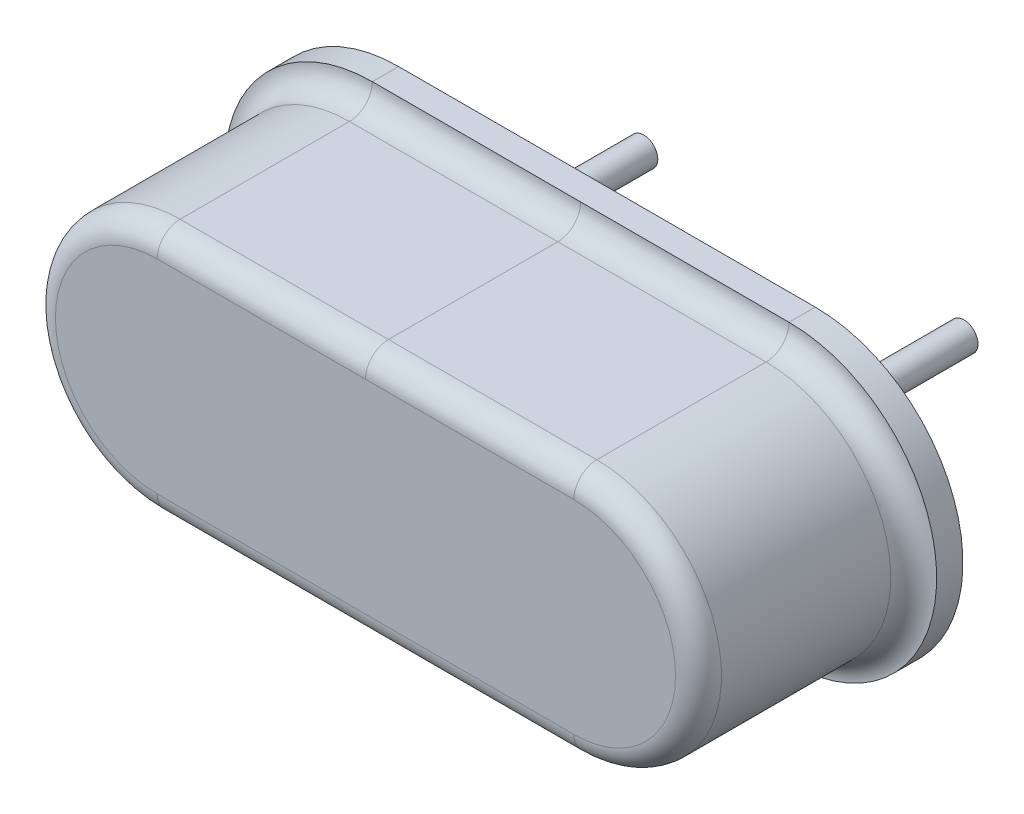
from build123d import *

# Parameters (mm, degrees)
BOSS_EXTRUDE1_DEPTH = 3.68
SKETCH4_R           = 0.215
BOSS_EXTRUDE2_DEPTH = 3


with BuildPart() as part:
    # Sketch1 → Boss-Extrude1 (new body)
    with BuildSketch(Plane.XY):
        with BuildLine():
            Line((-3.175, 2.25), (3.175, 2.25))
            ThreePointArc((3.175, 2.25), (5.425, 0), (3.175, -2.25))
            Line((3.175, -2.25), (-3.175, -2.25))
            ThreePointArc((-3.175, -2.25), (-5.425, 0), (-3.175, 2.25))
        make_face()
    extrude(amount=BOSS_EXTRUDE1_DEPTH)

    # Cut-Sweep1: sweep along a path in Sketch1<2>
    with BuildLine(Plane.XY) as cut_sweep1_path:
        Line((-3.175, 2.25), (3.175, 2.25))
        ThreePointArc((3.175, 2.25), (5.425, 0), (3.175, -2.25))
        Line((3.175, -2.25), (-3.175, -2.25))
        ThreePointArc((-3.175, -2.25), (-5.425, 0), (-3.175, 2.25))
    # Sketch2 → Cut-Sweep1 (sweep, cut)
    with BuildSketch(Plane(origin=(0, 0, 0), x_dir=(0, 0, -1), z_dir=(1, 0, 0))):
        with BuildLine():
            Line((-0.75, 1.9), (-3.33, 1.9))
            ThreePointArc((-3.33, 1.9), (-3.577487373, 1.797487373), (-3.68, 1.55))
            Line((-3.68, 1.55), (-3.68, 2.25))
            Line((-3.68, 2.25), (-0.4, 2.25))
            ThreePointArc((-0.4, 2.25), (-0.502512627, 2.002512627), (-0.75, 1.9))
        make_face()
    sweep(path=cut_sweep1_path.line, mode=Mode.SUBTRACT)

    # Sketch4 → Boss-Extrude2 (add)
    with BuildSketch(Plane(origin=(0, 0, 0), x_dir=(-1, 0, 0), z_dir=(0, 0, -1))):
        with Locations((-2.44, 0)):
            Circle(SKETCH4_R)
        with Locations((2.44, 0)):
            Circle(SKETCH4_R)
    extrude(amount=BOSS_EXTRUDE2_DEPTH)


solid = part.part
